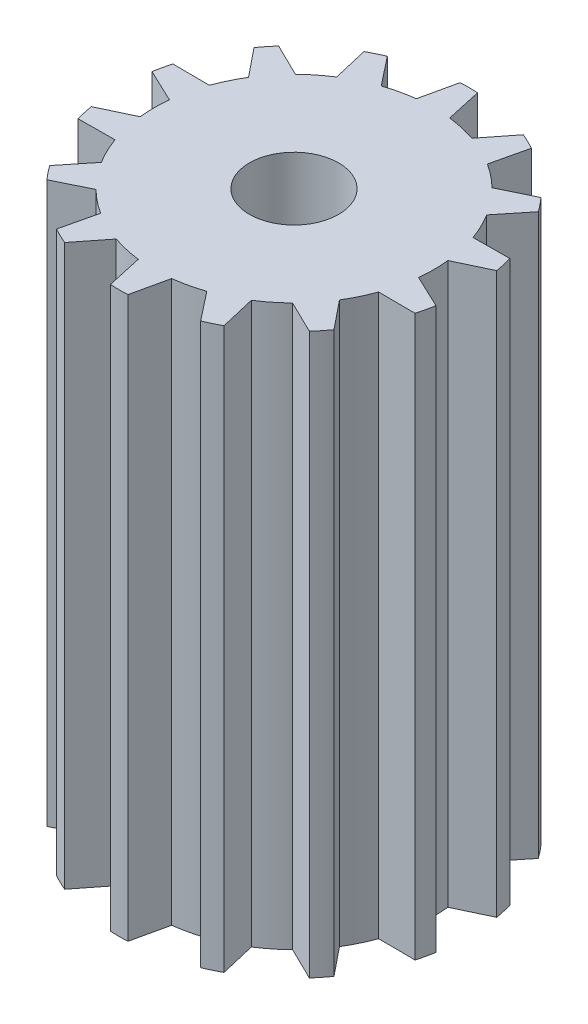
from build123d import *

# Parameters (mm, degrees)
BOSS_EXTRUDE1_DEPTH = 16
SKETCH2_R           = 1.275
CUT_EXTRUDE1_DEPTH  = 18.471332994


with BuildPart() as part:
    # Sketch1 → Boss-Extrude1 (new body)
    with BuildSketch(Plane(origin=(0, 0, 0), x_dir=(1, 0, 0), z_dir=(0, 1, 0))):
        with BuildLine():
            Line((-0.25, 4.993746089), (-0.476626074, 3.971501931))
            ThreePointArc((-0.476626074, 3.971501931), (-0.890083736, 3.899711649), (-1.293744854, 3.784999901))
            Line((-1.293744854, 3.784999901), (-1.941463008, 4.607680695))
            ThreePointArc((-1.941463008, 4.607680695), (-2.169418696, 4.50484434), (-2.391947442, 4.390738825))
            Line((-2.391947442, 4.390738825), (-2.152595362, 3.371399295))
            ThreePointArc((-2.152595362, 3.371399295), (-2.493959207, 3.12732593), (-2.807873746, 2.848832222))
            Line((-2.807873746, 2.848832222), (-3.748395457, 3.30900763))
            ThreePointArc((-3.748395457, 3.30900763), (-3.909157412, 3.117449009), (-4.060140358, 2.918091889))
            Line((-4.060140358, 2.918091889), (-3.402216738, 2.103549682))
            ThreePointArc((-3.402216738, 2.103549682), (-3.603875472, 1.735534956), (-3.765868806, 1.348418382))
            Line((-3.765868806, 1.348418382), (-4.812912215, 1.354945022))
            ThreePointArc((-4.812912215, 1.354945022), (-4.874639561, 1.11260467), (-4.924172682, 0.867481066))
            Line((-4.924172682, 0.867481066), (-3.977987365, 0.419066256))
            ThreePointArc((-3.977987365, 0.419066256), (-4, 0), (-3.977987365, -0.419066256))
            Line((-3.977987365, -0.419066256), (-4.924172682, -0.867481066))
            ThreePointArc((-4.924172682, -0.867481066), (-4.874639561, -1.11260467), (-4.812912215, -1.354945022))
            Line((-4.812912215, -1.354945022), (-3.765868806, -1.348418382))
            ThreePointArc((-3.765868806, -1.348418382), (-3.603875472, -1.735534956), (-3.402216738, -2.103549682))
            Line((-3.402216738, -2.103549682), (-4.060140358, -2.918091889))
            ThreePointArc((-4.060140358, -2.918091889), (-3.909157412, -3.117449009), (-3.748395457, -3.30900763))
            Line((-3.748395457, -3.30900763), (-2.807873746, -2.848832222))
            ThreePointArc((-2.807873746, -2.848832222), (-2.493959207, -3.12732593), (-2.152595362, -3.371399295))
            Line((-2.152595362, -3.371399295), (-2.391947442, -4.390738825))
            ThreePointArc((-2.391947442, -4.390738825), (-2.169418696, -4.50484434), (-1.941463008, -4.607680695))
            Line((-1.941463008, -4.607680695), (-1.293744854, -3.784999901))
            ThreePointArc((-1.293744854, -3.784999901), (-0.890083736, -3.899711649), (-0.476626074, -3.971501931))
            Line((-0.476626074, -3.971501931), (-0.25, -4.993746089))
            ThreePointArc((-0.25, -4.993746089), (0, -5), (0.25, -4.993746089))
            Line((0.25, -4.993746089), (0.476626074, -3.971501931))
            ThreePointArc((0.476626074, -3.971501931), (0.890083736, -3.899711649), (1.293744854, -3.784999901))
            Line((1.293744854, -3.784999901), (1.941463008, -4.607680695))
            ThreePointArc((1.941463008, -4.607680695), (2.169418696, -4.50484434), (2.391947442, -4.390738825))
            Line((2.391947442, -4.390738825), (2.152595362, -3.371399295))
            ThreePointArc((2.152595362, -3.371399295), (2.493959207, -3.12732593), (2.807873746, -2.848832222))
            Line((2.807873746, -2.848832222), (3.748395457, -3.30900763))
            ThreePointArc((3.748395457, -3.30900763), (3.909157412, -3.117449009), (4.060140358, -2.918091889))
            Line((4.060140358, -2.918091889), (3.402216738, -2.103549682))
            ThreePointArc((3.402216738, -2.103549682), (3.603875472, -1.735534956), (3.765868806, -1.348418382))
            Line((3.765868806, -1.348418382), (4.812912215, -1.354945022))
            ThreePointArc((4.812912215, -1.354945022), (4.874639561, -1.11260467), (4.924172682, -0.867481066))
            Line((4.924172682, -0.867481066), (3.977987365, -0.419066256))
            ThreePointArc((3.977987365, -0.419066256), (4, 0), (3.977987365, 0.419066256))
            Line((3.977987365, 0.419066256), (4.924172682, 0.867481066))
            ThreePointArc((4.924172682, 0.867481066), (4.874639561, 1.11260467), (4.812912215, 1.354945022))
            Line((4.812912215, 1.354945022), (3.765868806, 1.348418382))
            ThreePointArc((3.765868806, 1.348418382), (3.603875472, 1.735534956), (3.402216738, 2.103549682))
            Line((3.402216738, 2.103549682), (4.060140358, 2.918091889))
            ThreePointArc((4.060140358, 2.918091889), (3.909157412, 3.117449009), (3.748395457, 3.30900763))
            Line((3.748395457, 3.30900763), (2.807873746, 2.848832222))
            ThreePointArc((2.807873746, 2.848832222), (2.493959207, 3.12732593), (2.152595362, 3.371399295))
            Line((2.152595362, 3.371399295), (2.391947442, 4.390738825))
            ThreePointArc((2.391947442, 4.390738825), (2.169418696, 4.50484434), (1.941463008, 4.607680695))
            Line((1.941463008, 4.607680695), (1.293744854, 3.784999901))
            ThreePointArc((1.293744854, 3.784999901), (0.890083736, 3.899711649), (0.476626074, 3.971501931))
            Line((0.476626074, 3.971501931), (0.25, 4.993746089))
            ThreePointArc((0.25, 4.993746089), (0, 5), (-0.25, 4.993746089))
        make_face()
    extrude(amount=BOSS_EXTRUDE1_DEPTH)

    # Sketch2 → Cut-Extrude1 (cut, through all)
    with BuildSketch(Plane.XZ):
        with Locations(Location((0, 0, 0), (0, 0, 270))):
            Circle(SKETCH2_R)
    extrude(amount=-CUT_EXTRUDE1_DEPTH, mode=Mode.SUBTRACT)


solid = part.part
